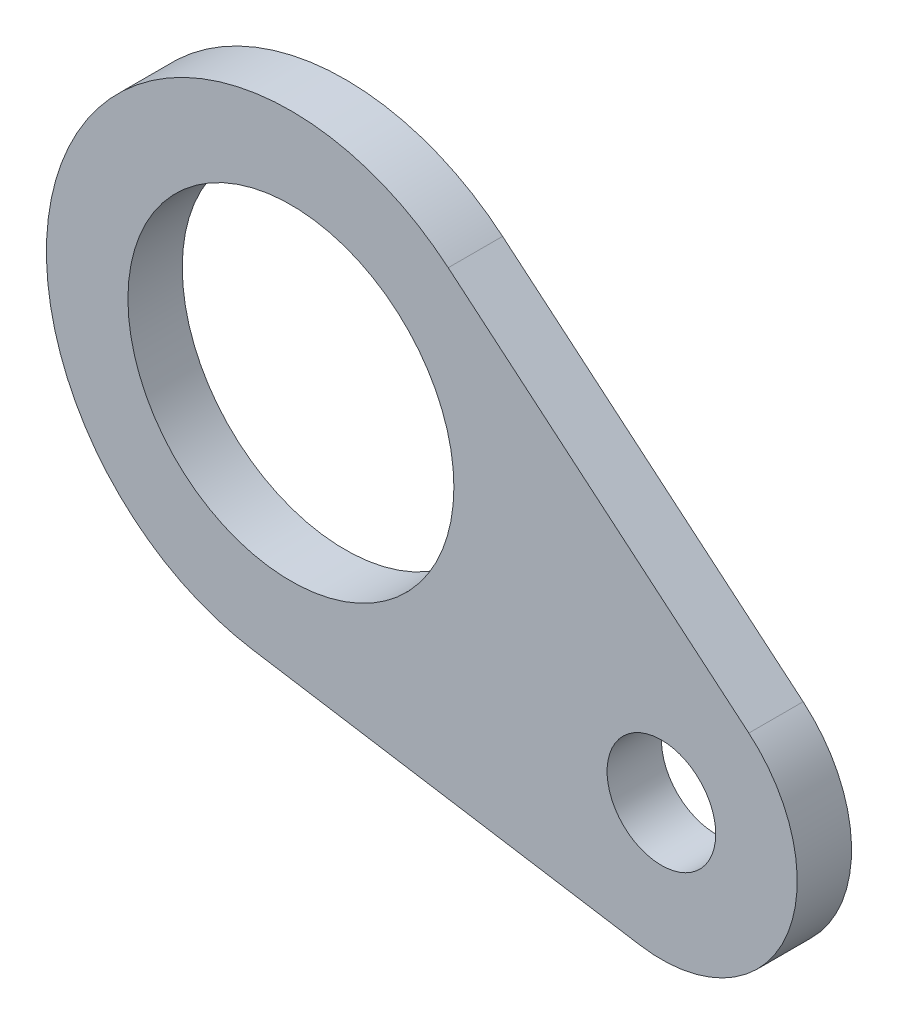
from build123d import *

# Parameters (mm, degrees)
SKETCH38_R           = 1
SKETCH38_R_2         = 3
BOSS_EXTRUDE13_DEPTH = 1


with BuildPart() as part:
    # Sketch38 → Boss-Extrude13 (new body)
    with BuildSketch(Plane.XY):
        with BuildLine():
            Line((-108.494409164, 54.419327267), (-102.96166585, 49.76758013))
            ThreePointArc((-102.96166585, 49.76758013), (-102.297234364, 46.813735607), (-104.966934961, 45.385672096))
            Line((-104.966934961, 45.385672096), (-112.103893563, 46.531892806))
            ThreePointArc((-112.103893563, 46.531892806), (-115.482211238, 52.847505974), (-108.494409164, 54.419327267))
        make_face()
        with Locations((-104.570506239, 47.854040843)):
            Circle(SKETCH38_R, mode=Mode.SUBTRACT)
        with Locations((-111.390321863, 50.97495655)):
            Circle(SKETCH38_R_2, mode=Mode.SUBTRACT)
    extrude(amount=BOSS_EXTRUDE13_DEPTH)


solid = part.part
